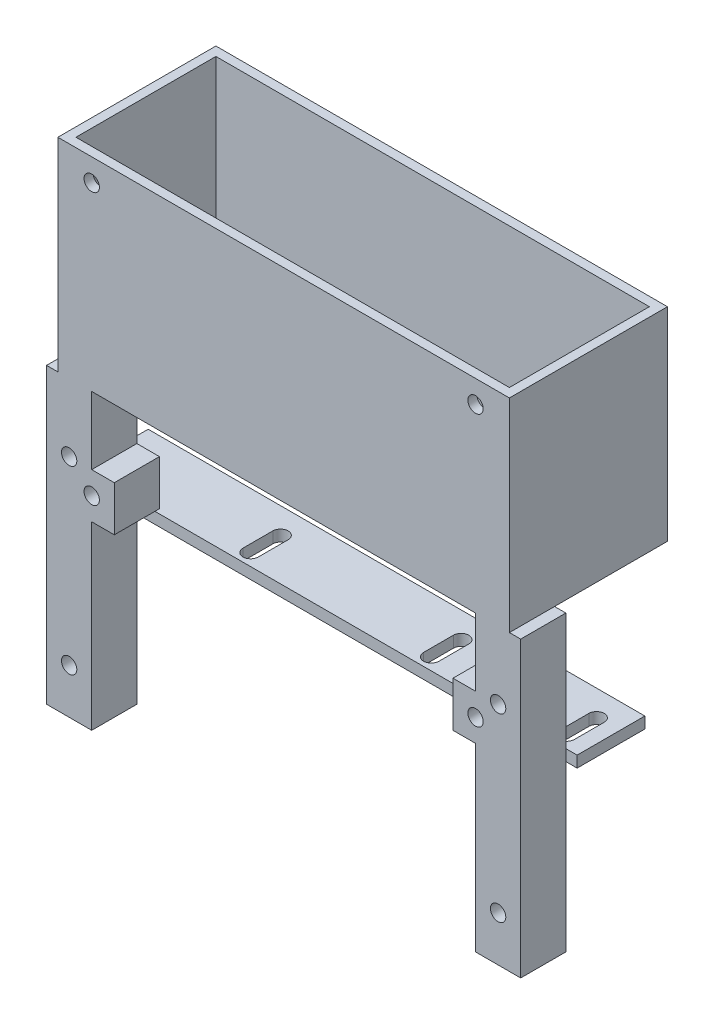
from build123d import *

# Parameters (mm, degrees)
V3_BOX_FOOTPRINT_100_X_45_MM_W                 = 100
V3_BOX_FOOTPRINT_100_X_45_MM_H                 = 45
V3_BOX_HEIGHT_35_MM_DEPTH                      = 35
V3_REAR_OPENING_96_X_31_MM_W                   = 96
V3_REAR_OPENING_96_X_31_MM_H                   = 31
V3_CAVITY_ALL_WALLS_2_MM_DEPTH                 = 43
V3_SQUARE_BEAMS_10_X_10_PITCH_95_MM_W          = 10
V3_SQUARE_BEAMS_10_X_10_PITCH_95_MM_H          = 10
V3_FORWARD_BEAM_LENGTH_65_MM_DEPTH             = 65
V3_LEFT_PCB_EAR_PROFILE_W                      = 10
V3_LEFT_PCB_EAR_PROFILE_H                      = 10
V3_LEFT_INWARD_EAR_5_MM_DEPTH                  = 5
V3_RIGHT_PCB_EAR_PROFILE_W                     = 10
V3_RIGHT_PCB_EAR_PROFILE_H                     = 10
V3_RIGHT_INWARD_EAR_5_MM_DEPTH                 = 5
V3_PCB_ROOF_PAIR_PITCH_85_MM_R                 = 1.7
V3_M3_ROOF_HOLES_DIAMETER_3_4_MM_DEPTH         = 2
V3_PCB_FORWARD_PAIR_ROW_SPACING_60_MM_R        = 1.7
V3_M3_PCB_EAR_HOLES_DEPTH                      = 10
V3_CHASSIS_TOP_HOLES_WIDTH_95_DEPTH_40_M_R     = 1.7
V3_M3_BEAM_TOP_BOTTOM_HOLES_DEPTH              = 10
V3_HANGING_PLATE_OFFSET_26_THICKNESS_2_5_W     = 110
V3_HANGING_PLATE_OFFSET_26_THICKNESS_2_5_H     = 2.5
V3_MOUNTING_PLATE_DOWNWARD_15_MM_WIDTH_1_DEPTH = 15
V3_FOUR_MOUNTING_SLOTS_3_4_X_10_MM_DEPTH       = 2.5


with BuildPart() as part:
    # V3 box footprint 100 x 45 mm → V3 box height 35 mm (new body)
    with BuildSketch(Plane.XY):
        with Locations((0, 22.5)):
            Rectangle(V3_BOX_FOOTPRINT_100_X_45_MM_W, V3_BOX_FOOTPRINT_100_X_45_MM_H)
    extrude(amount=V3_BOX_HEIGHT_35_MM_DEPTH)

    # V3 rear opening 96 x 31 mm → V3 cavity all walls 2 mm (cut)
    with BuildSketch(Plane(origin=(0, 45, 0), x_dir=(1, 0, 0), z_dir=(0, 1, 0))):
        with Locations((0, -17.5)):
            Rectangle(V3_REAR_OPENING_96_X_31_MM_W, V3_REAR_OPENING_96_X_31_MM_H)
    extrude(amount=-V3_CAVITY_ALL_WALLS_2_MM_DEPTH, mode=Mode.SUBTRACT)

    # V3 square beams 10 x 10 pitch 95 mm → V3 forward beam length 65 mm (add)
    with BuildSketch(Plane.XZ):
        with Locations((-47.5, 30)):
            Rectangle(V3_SQUARE_BEAMS_10_X_10_PITCH_95_MM_W, V3_SQUARE_BEAMS_10_X_10_PITCH_95_MM_H)
        with Locations((47.5, 30)):
            Rectangle(V3_SQUARE_BEAMS_10_X_10_PITCH_95_MM_W, V3_SQUARE_BEAMS_10_X_10_PITCH_95_MM_H)
    extrude(amount=V3_FORWARD_BEAM_LENGTH_65_MM_DEPTH)

    # V3 left PCB ear profile → V3 left inward ear 5 mm (add)
    with BuildSketch(Plane(origin=(-42.5, 0, 0), x_dir=(0, 0, -1), z_dir=(1, 0, 0))):
        with Locations((-30, -20)):
            Rectangle(V3_LEFT_PCB_EAR_PROFILE_W, V3_LEFT_PCB_EAR_PROFILE_H)
    extrude(amount=V3_LEFT_INWARD_EAR_5_MM_DEPTH)

    # V3 right PCB ear profile → V3 right inward ear 5 mm (add)
    with BuildSketch(Plane.ZY.offset(-42.5)):
        with Locations((30, -20)):
            Rectangle(V3_RIGHT_PCB_EAR_PROFILE_W, V3_RIGHT_PCB_EAR_PROFILE_H)
    extrude(amount=V3_RIGHT_INWARD_EAR_5_MM_DEPTH)

    # V3 PCB roof pair pitch 85 mm → V3 M3 roof holes diameter 3.4 mm (cut)
    with BuildSketch(Plane.XY.offset(35)):
        with Locations((-42.5, 40)):
            Circle(V3_PCB_ROOF_PAIR_PITCH_85_MM_R)
        with Locations((42.5, 40)):
            Circle(V3_PCB_ROOF_PAIR_PITCH_85_MM_R)
    extrude(amount=-V3_M3_ROOF_HOLES_DIAMETER_3_4_MM_DEPTH, mode=Mode.SUBTRACT)

    # V3 PCB forward pair row spacing 60 mm → V3 M3 PCB ear holes (cut)
    with BuildSketch(Plane.XY.offset(35)):
        with Locations((-42.5, -20)):
            Circle(V3_PCB_FORWARD_PAIR_ROW_SPACING_60_MM_R)
        with Locations((42.5, -20)):
            Circle(V3_PCB_FORWARD_PAIR_ROW_SPACING_60_MM_R)
    extrude(amount=-V3_M3_PCB_EAR_HOLES_DEPTH, mode=Mode.SUBTRACT)

    # V3 chassis top holes width 95 depth 40 mm → V3 M3 beam top bottom holes (cut)
    with BuildSketch(Plane.XY.offset(35)):
        with Locations((-47.5, -55)):
            Circle(V3_CHASSIS_TOP_HOLES_WIDTH_95_DEPTH_40_M_R)
        with Locations((-47.5, -15)):
            Circle(V3_CHASSIS_TOP_HOLES_WIDTH_95_DEPTH_40_M_R)
        with Locations((47.5, -55)):
            Circle(V3_CHASSIS_TOP_HOLES_WIDTH_95_DEPTH_40_M_R)
        with Locations((47.5, -15)):
            Circle(V3_CHASSIS_TOP_HOLES_WIDTH_95_DEPTH_40_M_R)
    extrude(amount=-V3_M3_BEAM_TOP_BOTTOM_HOLES_DEPTH, mode=Mode.SUBTRACT)

    # V3 hanging plate offset 26 thickness 2.5 mm → V3 mounting plate downward 15 mm width 110 (add)
    with BuildSketch(Plane(origin=(0, 0, 25), x_dir=(-1, 0, 0), z_dir=(0, 0, -1))):
        with Locations((0, -27.25)):
            Rectangle(V3_HANGING_PLATE_OFFSET_26_THICKNESS_2_5_W, V3_HANGING_PLATE_OFFSET_26_THICKNESS_2_5_H)
    extrude(amount=V3_MOUNTING_PLATE_DOWNWARD_15_MM_WIDTH_1_DEPTH)

    # V3 slots 6 mm below beam underside centers 20 and 50 → V3 four mounting slots 3.4 x 10 mm (cut)
    with BuildSketch(Plane.XZ.offset(28.5)):
        with BuildLine():
            Line((-51.7, 15.7), (-51.7, 22.3))
            ThreePointArc((-51.7, 22.3), (-50, 24), (-48.3, 22.3))
            Line((-48.3, 22.3), (-48.3, 15.7))
            ThreePointArc((-48.3, 15.7), (-50, 14), (-51.7, 15.7))
        make_face()
        with BuildLine():
            Line((-21.7, 15.7), (-21.7, 22.3))
            ThreePointArc((-21.7, 22.3), (-20, 24), (-18.3, 22.3))
            Line((-18.3, 22.3), (-18.3, 15.7))
            ThreePointArc((-18.3, 15.7), (-20, 14), (-21.7, 15.7))
        make_face()
        with BuildLine():
            Line((18.3, 15.7), (18.3, 22.3))
            ThreePointArc((18.3, 22.3), (20, 24), (21.7, 22.3))
            Line((21.7, 22.3), (21.7, 15.7))
            ThreePointArc((21.7, 15.7), (20, 14), (18.3, 15.7))
        make_face()
        with BuildLine():
            Line((48.3, 15.7), (48.3, 22.3))
            ThreePointArc((48.3, 22.3), (50, 24), (51.7, 22.3))
            Line((51.7, 22.3), (51.7, 15.7))
            ThreePointArc((51.7, 15.7), (50, 14), (48.3, 15.7))
        make_face()
    extrude(amount=-V3_FOUR_MOUNTING_SLOTS_3_4_X_10_MM_DEPTH, mode=Mode.SUBTRACT)


solid = part.part
